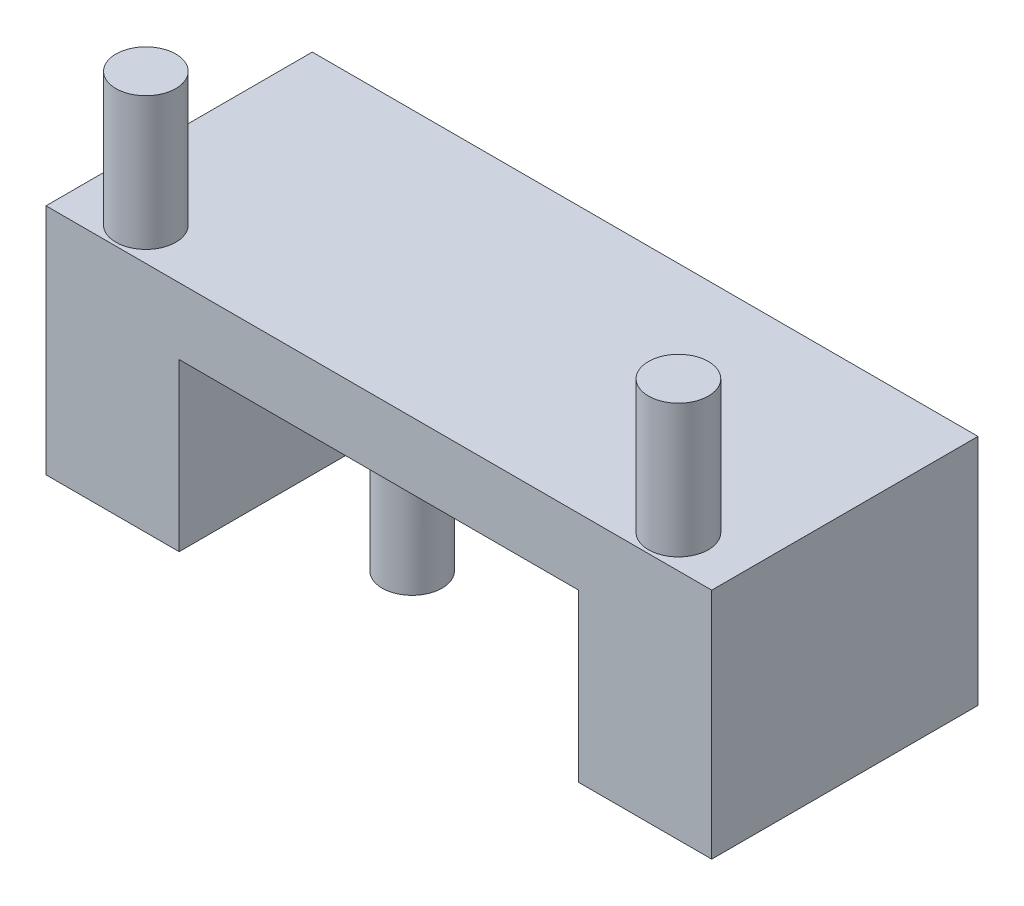
from build123d import *

# Parameters (mm, degrees)
SKETCH1_W                = 25.4
SKETCH1_H                = 10.16
BOSS_EXTRUDE1_DEPTH      = 8.89
SKETCH2_W                = 15.24
SKETCH2_H                = 10.16
CUT_EXTRUDE1_DEPTH       = 7.62
BOSS_EXTRUDE2_DEPTH      = 5.08
BOSS_EXTRUDE2_DEPTH_BACK = 5.08
SKETCH3_R                = 1.143
SKETCH3_5_R              = 1.143
BOSS_EXTRUDE3_DEPTH      = 6.35


with BuildPart() as part:
    # Sketch1 → Boss-Extrude1 (new body)
    with BuildSketch(Plane(origin=(0, 0, 0), x_dir=(1, 0, 0), z_dir=(0, 1, 0))):
        with Locations((12.7, -5.08)):
            Rectangle(SKETCH1_W, SKETCH1_H)
    extrude(amount=BOSS_EXTRUDE1_DEPTH)

    # Sketch2 → Cut-Extrude1 (cut)
    with BuildSketch(Plane(origin=(0, 6.35, 0), x_dir=(1, 0, 0), z_dir=(0, 1, 0))):
        with Locations((12.7, -5.08)):
            Rectangle(SKETCH2_W, SKETCH2_H)
    extrude(amount=-CUT_EXTRUDE1_DEPTH, mode=Mode.SUBTRACT)

    # Sketch3 → Boss-Extrude2 (add, two sides: drawn at the far end of the back side and taken through both)
    with BuildSketch(Plane(origin=(0, 8.89, 0), x_dir=(1, 0, 0), z_dir=(0, 1, 0)).offset(-BOSS_EXTRUDE2_DEPTH_BACK)):
        with Locations((2.54, -8.89)):
            Circle(SKETCH3_R)
        with Locations((22.86, -8.89)):
            Circle(SKETCH3_R)
    extrude(amount=BOSS_EXTRUDE2_DEPTH + BOSS_EXTRUDE2_DEPTH_BACK)

    # Sketch3<5> → Boss-Extrude3 (add)
    with BuildSketch(Plane(origin=(0, 8.89, 0), x_dir=(1, 0, 0), z_dir=(0, 1, 0))):
        with Locations((12.7, -8.89)):
            Circle(SKETCH3_5_R)
    extrude(amount=-BOSS_EXTRUDE3_DEPTH)


solid = part.part
